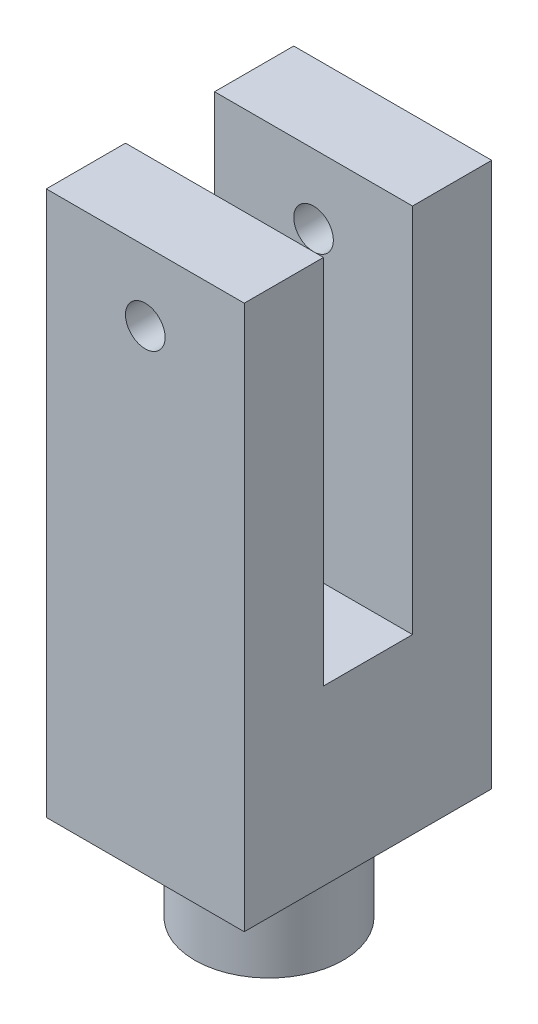
from build123d import *

# Parameters (mm, degrees)
SKETCH1_R           = 15
BOSS_EXTRUDE1_DEPTH = 20
SKETCH2_W           = 40
SKETCH2_H           = 50
BOSS_EXTRUDE2_DEPTH = 110
SKETCH3_W           = 18
SKETCH3_H           = 150
CUT_EXTRUDE1_DEPTH  = 139.293166859
SKETCH4_R           = 4
CUT_EXTRUDE2_DEPTH  = 141.712472795


with BuildPart() as part:
    # Sketch1 → Boss-Extrude1 (new body)
    with BuildSketch(Plane(origin=(0, 0, 0), x_dir=(1, 0, 0), z_dir=(0, 1, 0))):
        with Locations(Location((0, 0, 0), (0, 0, 270))):
            Circle(SKETCH1_R)
    extrude(amount=BOSS_EXTRUDE1_DEPTH)

    # Sketch2 → Boss-Extrude2 (add)
    with BuildSketch(Plane(origin=(0, 20, 0), x_dir=(1, 0, 0), z_dir=(0, 1, 0))):
        Rectangle(SKETCH2_W, SKETCH2_H)
    extrude(amount=BOSS_EXTRUDE2_DEPTH)

    # Sketch3 → Cut-Extrude1 (cut, through all)
    with BuildSketch(Plane(origin=(20, 0, 0), x_dir=(0, 0, -1), z_dir=(1, 0, 0))):
        with Locations((0, 130)):
            Rectangle(SKETCH3_W, SKETCH3_H)
    extrude(amount=-CUT_EXTRUDE1_DEPTH, mode=Mode.SUBTRACT)

    # Sketch4 → Cut-Extrude2 (cut, through all)
    with BuildSketch(Plane(origin=(0, 0, -25), x_dir=(-1, 0, 0), z_dir=(0, 0, -1))):
        with Locations((0, 116)):
            Circle(SKETCH4_R)
    extrude(amount=-CUT_EXTRUDE2_DEPTH, mode=Mode.SUBTRACT)


solid = part.part
